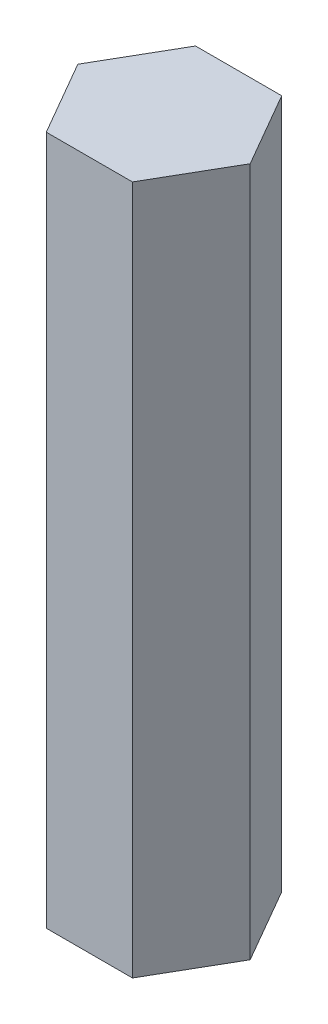
from build123d import *

# Parameters (mm, degrees)
BOSS_EXTRU_1_DEPTH = 24


with BuildPart() as part:
    # Esquisse3 → Boss.-Extru.1 (new body)
    with BuildSketch(Plane(origin=(0, 0, 0), x_dir=(1, 0, 0), z_dir=(0, 1, 0))):
        Polygon((3, 0), (1.5, 2.598076211), (-1.5, 2.598076211), (-3, 0), (-1.5, -2.598076211), (1.5, -2.598076211), align=None)
    extrude(amount=BOSS_EXTRU_1_DEPTH)


solid = part.part
